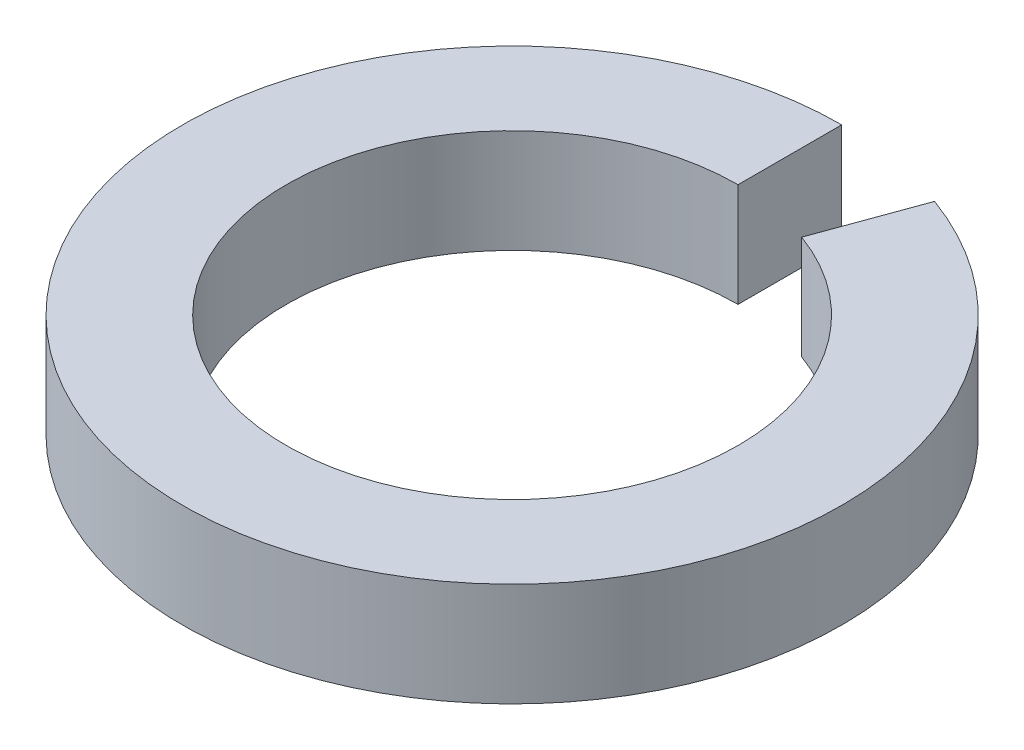
from build123d import *

# Parameters (mm, degrees)
BOSS_EXTRUDE1_DEPTH = 1.4


with BuildPart() as part:
    # Sketch1 → Boss-Extrude1 (new body)
    with BuildSketch(Plane(origin=(0, 0, 0), x_dir=(1, 0, 0), z_dir=(0, 1, 0))):
        with BuildLine():
            Line((0, 3.05), (0, 4.45))
            ThreePointArc((0, 4.45), (-0.772734391, -4.382394501), (1.521989638, 4.181632162))
            Line((1.521989638, 4.181632162), (1.043161437, 2.866062493))
            ThreePointArc((1.043161437, 2.866062493), (-0.529626942, -3.003663647), (0, 3.05))
        make_face()
    extrude(amount=BOSS_EXTRUDE1_DEPTH)


solid = part.part
